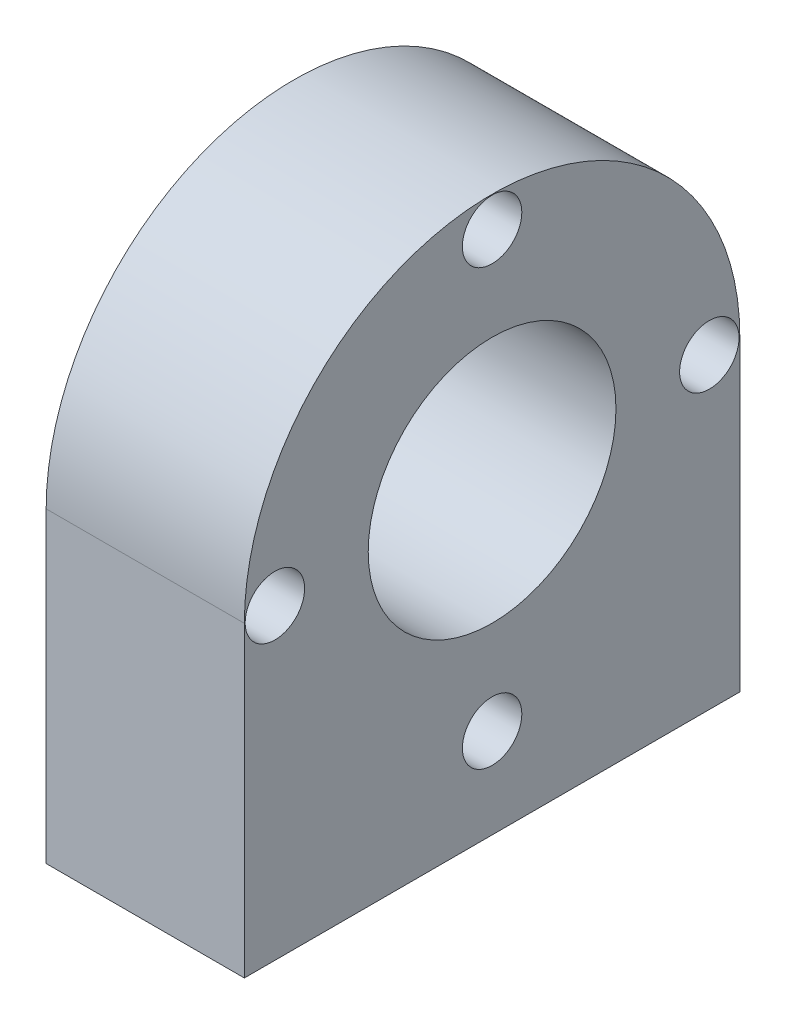
from build123d import *

# Parameters (mm, degrees)
SKIZZE1_W                            = 20
SKIZZE1_H                            = 50
AUFSATZ_LINEAR_AUSTRAGEN1_DEPTH      = 56
SKIZZE2_R                            = 12.5
SCHNITT_LINEAR_AUSTRAGEN1_DEPTH      = 65.505813691
SKIZZE3_R                            = 1.65
SCHNITT_LINEAR_AUSTRAGEN2_DEPTH      = 15
SKIZZE4_R                            = 1.5
SCHNITT_LINEAR_AUSTRAGEN3_DEPTH      = 20
SCHNITT_LINEAR_AUSTRAGEN4_DEPTH      = 65.505813691
SCHNITT_LINEAR_AUSTRAGEN4_DEPTH_BACK = 12
SKIZZE5_R                            = 12.5
SKIZZE5_R_2                          = 3


with BuildPart() as part:
    # Skizze1 → Aufsatz-Linear austragen1 (new body)
    with BuildSketch(Plane(origin=(0, 0, 0), x_dir=(1, 0, 0), z_dir=(0, 1, 0))):
        Rectangle(SKIZZE1_W, SKIZZE1_H)
    extrude(amount=AUFSATZ_LINEAR_AUSTRAGEN1_DEPTH)

    # Skizze2 → Schnitt-Linear austragen1 (cut, through all)
    with BuildSketch(Plane.ZY.offset(10)):
        with BuildLine():
            Line((-25, 56), (-25, 31))
            ThreePointArc((-25, 31), (-17.677669509, 48.67766955), (5.8e-08, 56))
            Line((5.8e-08, 56), (-25, 56))
        make_face()
        with BuildLine():
            ThreePointArc((5.8e-08, 56), (17.67766955, 48.677669509), (25, 31))
            Line((25, 31), (25, 56))
            Line((25, 56), (5.8e-08, 56))
        make_face()
        with Locations((0, 31)):
            Circle(SKIZZE2_R)
    extrude(amount=-SCHNITT_LINEAR_AUSTRAGEN1_DEPTH, mode=Mode.SUBTRACT)

    # Skizze3 → Schnitt-Linear austragen2 (cut)
    with BuildSketch(Plane.XZ):
        with Locations(Location((0, 19, 0), (0, 0, 270))):
            Circle(SKIZZE3_R)
        with Locations(Location((0, 9, 0), (0, 0, 270))):
            Circle(SKIZZE3_R)
        with Locations(Location((0, -9, 0), (0, 0, 90))):
            Circle(SKIZZE3_R)
        with Locations(Location((0, -19, 0), (0, 0, 90))):
            Circle(SKIZZE3_R)
    extrude(amount=-SCHNITT_LINEAR_AUSTRAGEN2_DEPTH, mode=Mode.SUBTRACT)

    # Skizze4 → Schnitt-Linear austragen3 (cut)
    with BuildSketch(Plane.ZY.offset(10)):
        with Locations((-21.920310217, 31)):
            Circle(SKIZZE4_R)
        with Locations((0, 52.920310217)):
            Circle(SKIZZE4_R)
        with Locations((21.920310217, 31)):
            Circle(SKIZZE4_R)
        with Locations((0, 9.079689783)):
            Circle(SKIZZE4_R)
    extrude(amount=-SCHNITT_LINEAR_AUSTRAGEN3_DEPTH, mode=Mode.SUBTRACT)

    # Skizze5 → Schnitt-Linear austragen4 (cut, two sides: drawn at the far end of the back side and taken through both)
    with BuildSketch(Plane(origin=(10, 0, 0), x_dir=(0, 0, -1), z_dir=(1, 0, 0)).offset(-SCHNITT_LINEAR_AUSTRAGEN4_DEPTH_BACK)):
        with Locations(Location((0, 31, 0), (0, 0, 180))):
            Circle(SKIZZE5_R)
        with Locations((21.920310217, 31)):
            Circle(SKIZZE5_R_2)
        with Locations((0, 9.079689783)):
            Circle(SKIZZE5_R_2)
        with Locations((-21.920310217, 31)):
            Circle(SKIZZE5_R_2)
        with Locations((0, 52.920310217)):
            Circle(SKIZZE5_R_2)
    extrude(amount=SCHNITT_LINEAR_AUSTRAGEN4_DEPTH + SCHNITT_LINEAR_AUSTRAGEN4_DEPTH_BACK, mode=Mode.SUBTRACT)


solid = part.part
